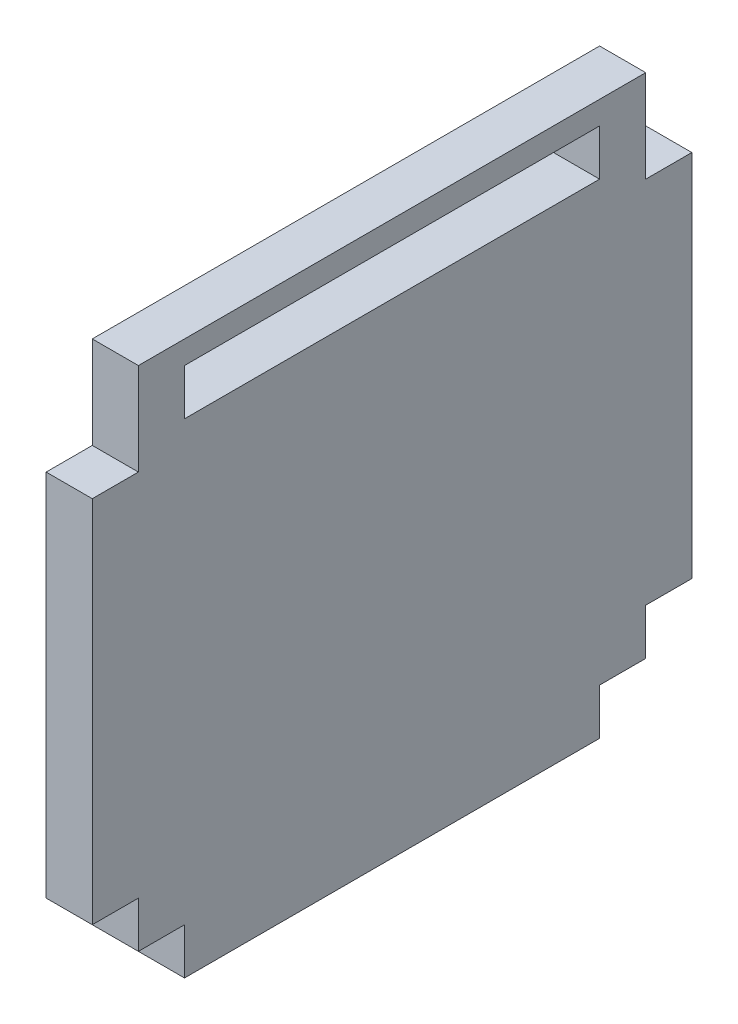
from build123d import *

# Parameters (mm, degrees)
SKETCH1_W           = 6.35
SKETCH1_H           = 76.2
BOSS_EXTRUDE1_DEPTH = 76.2
SKETCH2_W           = 6.35
SKETCH2_H           = 50.8
BOSS_EXTRUDE2_DEPTH = 6.35
SKETCH3_W           = 6.35
SKETCH3_H           = 6.35
SKETCH3_H_2         = 12.7
CUT_EXTRUDE1_DEPTH  = 86.430512699
SKETCH4_W           = 57.15
SKETCH4_H           = 6.35
CUT_EXTRUDE2_DEPTH  = 86.430512699


with BuildPart() as part:
    # Sketch1 → Boss-Extrude1 (new body)
    with BuildSketch(Plane.XY):
        with Locations((9.525, 0)):
            Rectangle(SKETCH1_W, SKETCH1_H)
    extrude(amount=BOSS_EXTRUDE1_DEPTH)

    # Sketch2 → Boss-Extrude2 (add)
    with BuildSketch(Plane.ZY.offset(-6.35)):
        with Locations((-3.175, 0)):
            Rectangle(SKETCH2_W, SKETCH2_H)
    extrude(amount=-BOSS_EXTRUDE2_DEPTH)

    # Sketch3 → Cut-Extrude1 (cut, through all)
    with BuildSketch(Plane.ZY.offset(-6.35)):
        Polygon((69.85, -38.1), (76.2, -38.1), (76.2, -25.4), (69.85, -25.4), (69.85, -31.75), (63.5, -31.75), (63.5, -38.1), align=None)
        with Locations((3.175, -34.925)):
            Rectangle(SKETCH3_W, SKETCH3_H)
        with Locations((73.025, 31.75)):
            Rectangle(SKETCH3_W, SKETCH3_H_2)
    extrude(amount=-CUT_EXTRUDE1_DEPTH, mode=Mode.SUBTRACT)

    # Sketch4 → Cut-Extrude2 (cut, through all)
    with BuildSketch(Plane.ZY.offset(-6.35)):
        with Locations((34.925, 31.75)):
            Rectangle(SKETCH4_W, SKETCH4_H)
    extrude(amount=-CUT_EXTRUDE2_DEPTH, mode=Mode.SUBTRACT)


solid = part.part
